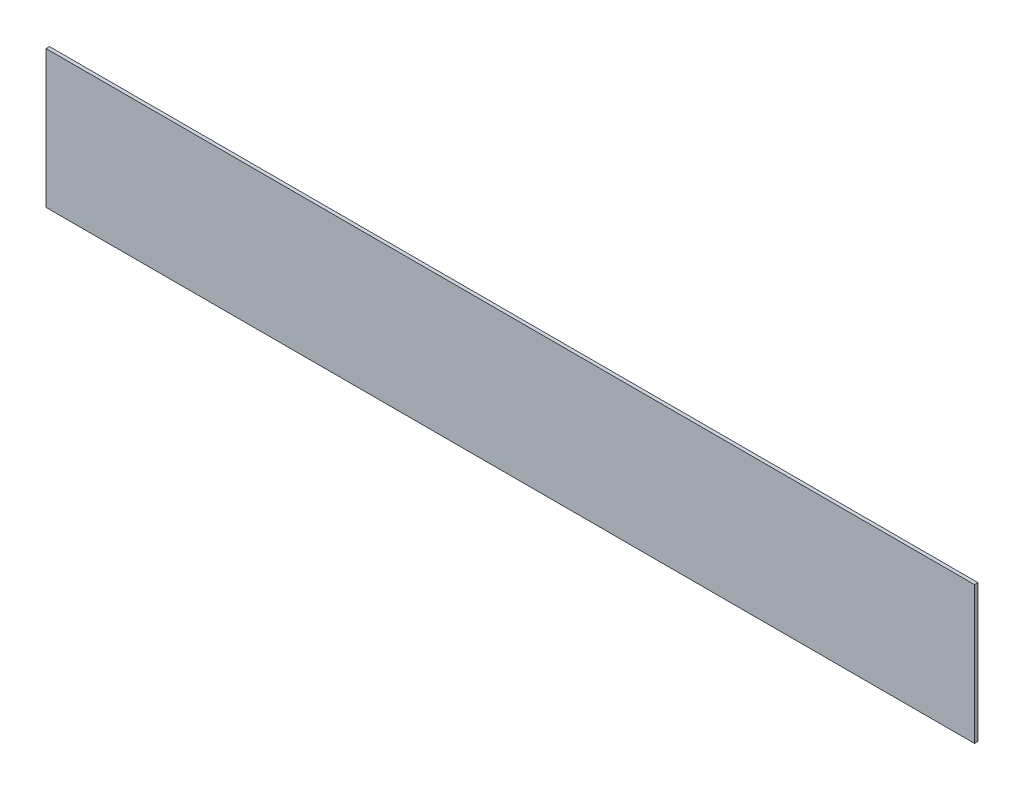
from build123d import *

# Parameters (mm, degrees)
ESQUISSE1_W        = 270
ESQUISSE1_H        = 40
BOSS_EXTRU_1_DEPTH = 1


with BuildPart() as part:
    # Esquisse1 → Boss.-Extru.1 (new body)
    with BuildSketch(Plane.XY):
        Rectangle(ESQUISSE1_W, ESQUISSE1_H)
    extrude(amount=BOSS_EXTRU_1_DEPTH)


solid = part.part
